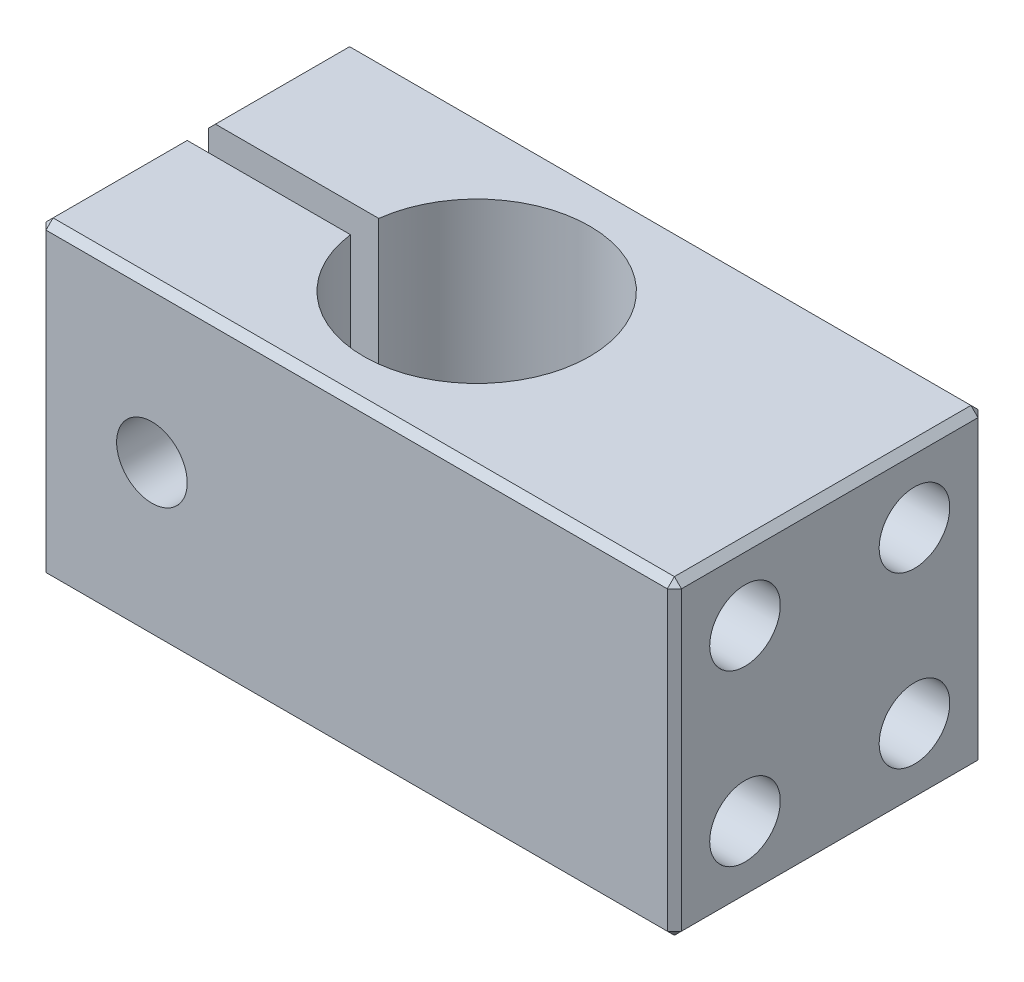
from build123d import *

# Parameters (mm, degrees)
SKETCH_5_W          = 45
SKETCH_5_H          = 22
EXTRUDE_2_DEPTH     = 22
CUT_EXTRUDE_3_DEPTH = 22
CUT_EXTRUDE_START   = 22.5
SKETCH_7_R          = 2.5
CUT_EXTRUDE_4_DEPTH = 10
CUT_EXTRUDE_START_2 = 11
SKETCH_8_R          = 2.5
CUT_EXTRUDE_5_DEPTH = 22
CHAMFER_1_SIZE      = 0.5


with BuildPart() as part:
    # 草图5 → 凸台-拉伸2 (new body)
    with BuildSketch(Plane(origin=(0, 0, 0), x_dir=(1, 0, 0), z_dir=(0, 1, 0))):
        Rectangle(SKETCH_5_W, SKETCH_5_H)
    extrude(amount=EXTRUDE_2_DEPTH)

    # 草图6 → 切除-拉伸3 (cut)
    with BuildSketch(Plane(origin=(0, 0, 0), x_dir=(1, 0, 0), z_dir=(0, 1, 0))):
        with BuildLine():
            Line((-22.5, -1), (-22.5, 1))
            Line((-22.5, 1), (-10.437253933, 1))
            ThreePointArc((-10.437253933, 1), (5.5, 0), (-10.437253933, -1))
            Line((-10.437253933, -1), (-22.5, -1))
        make_face()
    extrude(amount=CUT_EXTRUDE_3_DEPTH, mode=Mode.SUBTRACT)

    # 草图7 → 切除-拉伸4 (cut)
    with BuildSketch(Plane(origin=(0, 0, 0), x_dir=(0, 0, -1), z_dir=(1, 0, 0)).offset(CUT_EXTRUDE_START)):
        with Locations(Location((-6, 17, 0), (0, 0, 180))):
            Circle(SKETCH_7_R)
        with Locations(Location((-6, 5, 0), (0, 0, 180))):
            Circle(SKETCH_7_R)
        with Locations(Location((6, 17, 0), (0, 0, 180))):
            Circle(SKETCH_7_R)
        with Locations(Location((6, 5, 0), (0, 0, 180))):
            Circle(SKETCH_7_R)
    extrude(amount=-CUT_EXTRUDE_4_DEPTH, mode=Mode.SUBTRACT)

    # 草图8 → 切除-拉伸5 (cut)
    with BuildSketch(Plane.XY.offset(CUT_EXTRUDE_START_2)):
        with Locations((-14.5, 11)):
            Circle(SKETCH_8_R)
    extrude(amount=-CUT_EXTRUDE_5_DEPTH, mode=Mode.SUBTRACT)

    # 倒角1
    chamfer_1_edges = [part.edges().sort_by_distance(p)[0] for p in [
        (-22.5, 22, -6),
        (-22.5, 0, 6),
        (-22.5, 22, 6),
        (0, 22, 11),
        (22.5, 22, 0),
        (0, 0, 11),
        (-22.5, 0, -6),
        (0, 0, -11),
        (22.5, 0, 0),
        (22.5, 11, 11),
        (-22.5, 11, 11),
        (-22.5, 11, -11),
        (22.5, 11, -11),
        (0, 22, -11),
    ]]
    chamfer(chamfer_1_edges, length=CHAMFER_1_SIZE)


solid = part.part
